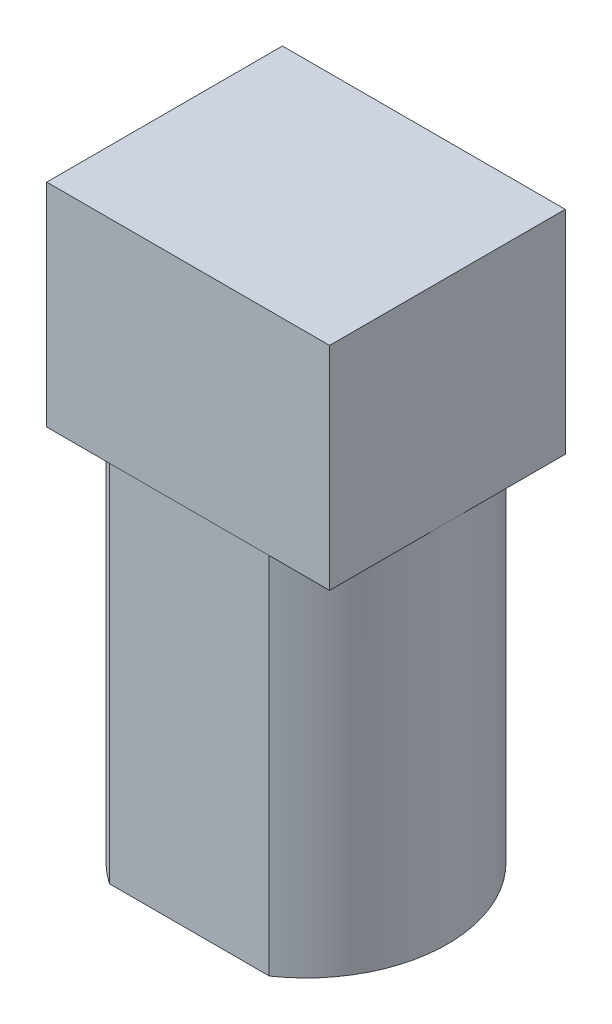
from build123d import *

# Parameters (mm, degrees)
BOSS_EXTRUDE1_DEPTH = 15.5
SKETCH2_W           = 12
SKETCH2_H           = 10
BOSS_EXTRUDE2_DEPTH = 9


with BuildPart() as part:
    # Sketch1 → Boss-Extrude1 (new body)
    with BuildSketch(Plane(origin=(0, 0, 0), x_dir=(1, 0, 0), z_dir=(0, 1, 0))):
        with BuildLine():
            Line((-3.390796367, 4.95), (3.390796367, 4.95))
            ThreePointArc((3.390796367, 4.95), (6, 0), (3.390796367, -4.95))
            Line((3.390796367, -4.95), (-3.390796367, -4.95))
            ThreePointArc((-3.390796367, -4.95), (-6, 0), (-3.390796367, 4.95))
        make_face()
    extrude(amount=BOSS_EXTRUDE1_DEPTH)

    # Sketch2 → Boss-Extrude2 (add)
    with BuildSketch(Plane(origin=(0, 15.5, 0), x_dir=(1, 0, 0), z_dir=(0, 1, 0))):
        Rectangle(SKETCH2_W, SKETCH2_H)
    extrude(amount=BOSS_EXTRUDE2_DEPTH)


solid = part.part
